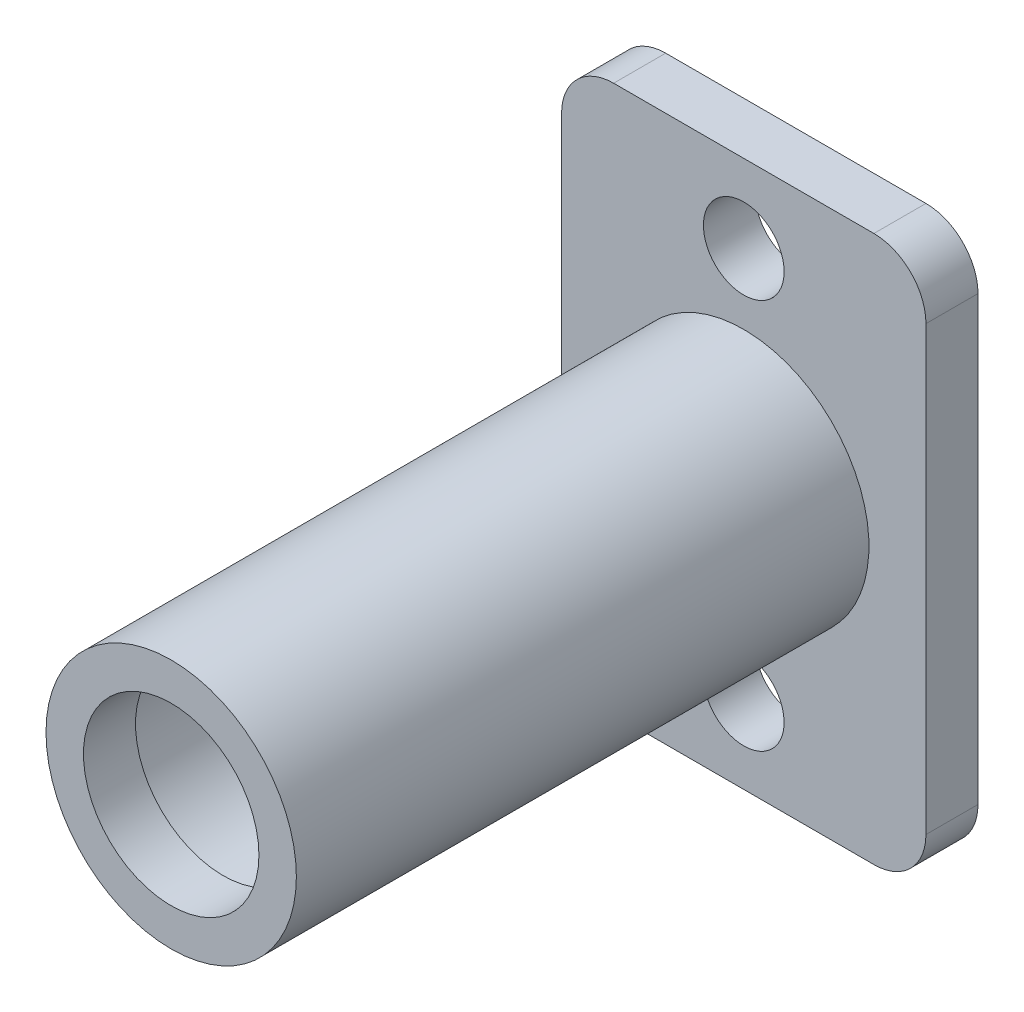
from build123d import *

# Parameters (mm, degrees)
SKETCH1_W           = 14
SKETCH1_H           = 21
SKETCH1_R           = 1.55
SKETCH1_R_2         = 3.81
BOSS_EXTRUDE1_DEPTH = 2
FILLET1_R           = 2
SKETCH3_R           = 4.81
SKETCH3_R_2         = 3.81
BOSS_EXTRUDE2_DEPTH = 20
SKETCH4_R           = 4.81
SKETCH4_R_2         = 3.371204608
BOSS_EXTRUDE3_DEPTH = 2


with BuildPart() as part:
    # Sketch1 → Boss-Extrude1 (new body)
    with BuildSketch(Plane.XY):
        Rectangle(SKETCH1_W, SKETCH1_H)
        with Locations((0, 7.5)):
            Circle(SKETCH1_R, mode=Mode.SUBTRACT)
        with Locations(Location((0, -7.5, 0), (0, 0, 180))):
            Circle(SKETCH1_R, mode=Mode.SUBTRACT)
        Circle(SKETCH1_R_2, mode=Mode.SUBTRACT)
    extrude(amount=BOSS_EXTRUDE1_DEPTH)

    # Fillet1
    fillet1_edges = [part.edges().sort_by_distance(p)[0] for p in [
        (7, -10.5, 1),
        (-7, -10.5, 1),
        (-7, 10.5, 1),
        (7, 10.5, 1),
    ]]
    fillet(fillet1_edges, radius=FILLET1_R)

    # Sketch3 → Boss-Extrude2 (add)
    with BuildSketch(Plane.XY.offset(2)):
        with Locations(Location((0, 0, 0), (0, 0, 180))):
            Circle(SKETCH3_R)
        Circle(SKETCH3_R_2, mode=Mode.SUBTRACT)
    extrude(amount=BOSS_EXTRUDE2_DEPTH)

    # Sketch4 → Boss-Extrude3 (add)
    with BuildSketch(Plane.XY.offset(22)):
        with Locations(Location((0, 0, 0), (0, 0, 180))):
            Circle(SKETCH4_R)
        Circle(SKETCH4_R_2, mode=Mode.SUBTRACT)
    extrude(amount=BOSS_EXTRUDE3_DEPTH)


solid = part.part
